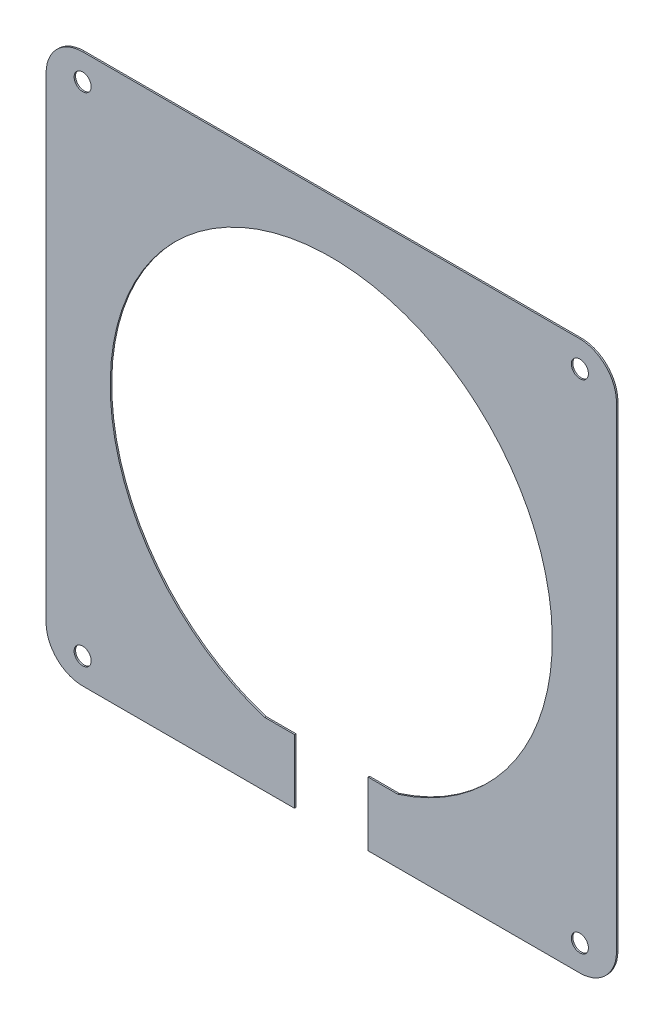
from build123d import *

# Parameters (mm, degrees)
SKETCH2_R           = 1.475
BOSS_EXTRUDE1_DEPTH = 0.254
FILLET1_R           = 6.35


with BuildPart() as part:
    # Sketch2 → Boss-Extrude1 (new body)
    # profile 1 of 3: a face of its own
    with BuildSketch(Plane.XY):
        with BuildLine():
            ThreePointArc((-6.35, -37.695902019), (-8.946499242, -37.165355915), (-11.5, -36.45618643))
            ThreePointArc((-11.5, -36.45618643), (-22.601913957, 30.829482878), (38.227, 0))
            ThreePointArc((38.227, 0), (30.829482878, -22.601913957), (11.5, -36.45618643))
            ThreePointArc((11.5, -36.45618643), (8.946499242, -37.165355915), (6.35, -37.695902019))
            Line((6.35, -37.695902019), (6.35, -47.5))
            Line((6.35, -47.5), (49.325, -47.5))
            Line((49.325, -47.5), (49.325, 47.5))
            Line((49.325, 47.5), (-49.325, 47.5))
            Line((-49.325, 47.5), (-49.325, -47.5))
            Line((-49.325, -47.5), (-6.35, -47.5))
            Line((-6.35, -47.5), (-6.35, -37.695902019))
        make_face()
        with Locations((-43, -43)):
            Circle(SKETCH2_R, mode=Mode.SUBTRACT)
        with Locations((43, -43)):
            Circle(SKETCH2_R, mode=Mode.SUBTRACT)
        with Locations((-43, 43)):
            Circle(SKETCH2_R, mode=Mode.SUBTRACT)
        with Locations((43, 43)):
            Circle(SKETCH2_R, mode=Mode.SUBTRACT)
    # profile 2 of 3: a face of its own
    with BuildSketch(Plane.XY):
        with BuildLine():
            Line((11.5, -36.45618643), (6.35, -36.45618643))
            Line((6.35, -36.45618643), (6.35, -37.695902019))
            ThreePointArc((6.35, -37.695902019), (8.946499242, -37.165355915), (11.5, -36.45618643))
        make_face()
    # profile 3 of 3: a face of its own
    with BuildSketch(Plane.XY):
        with BuildLine():
            Line((-6.35, -36.45618643), (-11.5, -36.45618643))
            ThreePointArc((-11.5, -36.45618643), (-8.946499242, -37.165355915), (-6.35, -37.695902019))
            Line((-6.35, -37.695902019), (-6.35, -36.45618643))
        make_face()
    extrude(amount=BOSS_EXTRUDE1_DEPTH)

    # Fillet1
    fillet1_edges = [part.edges().sort_by_distance(p)[0] for p in [
        (-49.325, -47.5, 0.127),
        (-49.325, 47.5, 0.127),
        (49.325, 47.5, 0.127),
        (49.325, -47.5, 0.127),
    ]]
    fillet(fillet1_edges, radius=FILLET1_R)


solid = part.part
